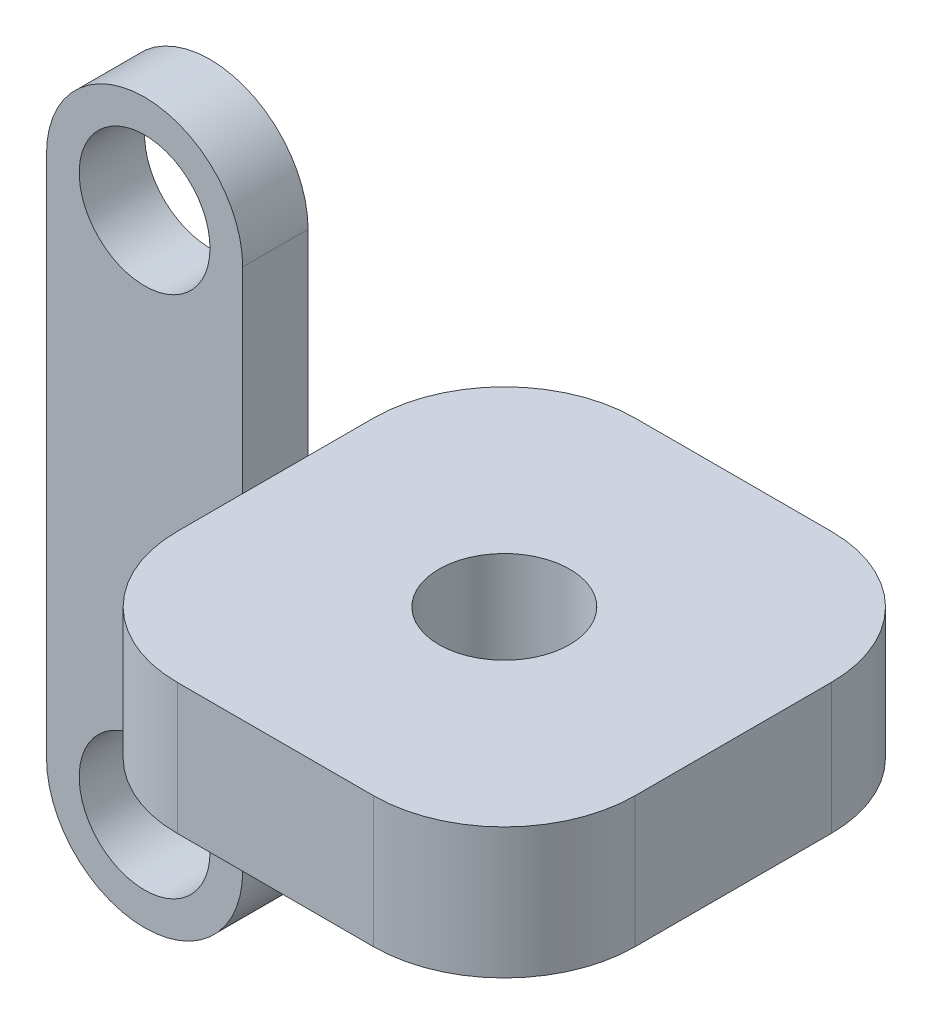
from build123d import *

# Parameters (mm, degrees)
EXTRUDE_1_DEPTH     = 5
SKETCH_2_R          = 5
CUT_EXTRUDE_1_DEPTH = 32.721443851
SKETCH_3_W          = 35
SKETCH_3_H          = 35
EXTRUDE_2_DEPTH     = 5
FILLET_1_R          = 10
SKETCH_4_R          = 5
CUT_EXTRUDE_2_DEPTH = 52.780787943


with BuildPart() as part:
    # 草图1 → 凸台-拉伸1 (new body)
    with BuildSketch(Plane.XY):
        with BuildLine():
            Line((0, 20), (0, -20))
            ThreePointArc((0, -20), (-7.5, -27.5), (-15, -20))
            Line((-15, -20), (-15, 20))
            ThreePointArc((-15, 20), (-7.5, 27.5), (0, 20))
        make_face()
    extrude(amount=EXTRUDE_1_DEPTH)

    # 草图2 → 切除-拉伸1 (cut, through all)
    with BuildSketch(Plane.XY.offset(5)):
        with Locations((-7.5, 20)):
            Circle(SKETCH_2_R)
        with Locations((-7.5, -20)):
            Circle(SKETCH_2_R)
    extrude(amount=-CUT_EXTRUDE_1_DEPTH, mode=Mode.SUBTRACT)

    # 草图3 → 凸台-拉伸2 (add, symmetric)
    with BuildSketch(Plane(origin=(0, 0, 0), x_dir=(1, 0, 0), z_dir=(0, 1, 0))):
        with Locations((17.5, -2.5)):
            Rectangle(SKETCH_3_W, SKETCH_3_H)
    extrude(amount=EXTRUDE_2_DEPTH, both=True)

    # 圆角1
    fillet_1_edges = [part.edges().sort_by_distance(p)[0] for p in [
        (0, 0, -15),
        (0, 0, 20),
        (35, 0, 20),
        (35, 0, -15),
    ]]
    fillet(fillet_1_edges, radius=FILLET_1_R)

    # 草图4 → 切除-拉伸2 (cut, through all)
    with BuildSketch(Plane(origin=(0, 5, 0), x_dir=(1, 0, 0), z_dir=(0, 1, 0))):
        with Locations(Location((17.5, -2.5, 0), (0, 0, 270))):
            Circle(SKETCH_4_R)
    extrude(amount=-CUT_EXTRUDE_2_DEPTH, mode=Mode.SUBTRACT)


solid = part.part
